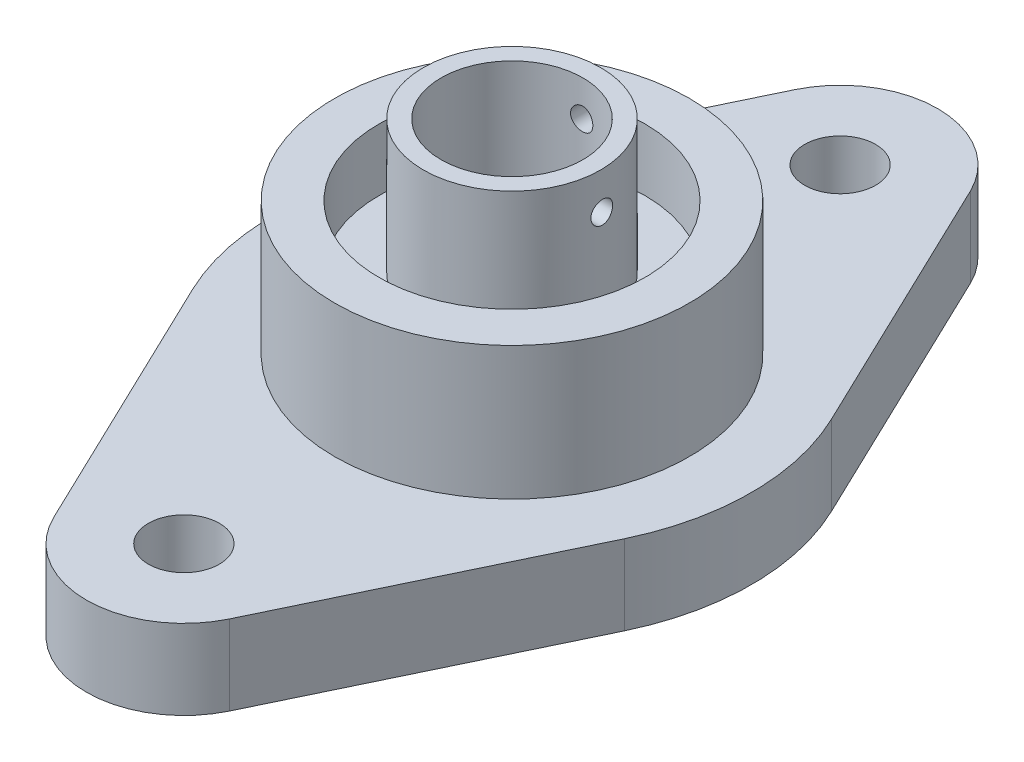
from build123d import *

# Parameters (mm, degrees)
SKETCH_1_R                         = 5
SKETCH_1_R_2                       = 4
EXTRUDE_1_DEPTH                    = 16
SKETCH_2_R                         = 7.5
SKETCH_2_R_2                       = 5
EXTRUDE_2_DEPTH                    = 8.5
SKETCH_3_R                         = 10
SKETCH_3_R_2                       = 7.5
EXTRUDE_3_DEPTH                    = 12
SKETCH_4_R                         = 10
SKETCH_4_R_2                       = 2
EXTRUDE_4_DEPTH                    = 4.5
HOLE_WIZARD_M1_6_1_REACH           = 35.405
HOLE_WIZARD_M1_6_1_BORE_R          = 0.625
HOLE_WIZARD_M1_6_1_ON_FACE_2_REACH = 36.922
HOLE_WIZARD_M1_6_1_BORE_2_R        = 0.625


with BuildPart() as part:
    # 草图1 → 凸台-拉伸1 (new body)
    with BuildSketch(Plane(origin=(0, 0, 0), x_dir=(1, 0, 0), z_dir=(0, 1, 0))):
        with Locations(Location((0, 0, 0), (0, 0, 270))):
            Circle(SKETCH_1_R)
        with Locations(Location((0, 0, 0), (0, 0, 270))):
            Circle(SKETCH_1_R_2, mode=Mode.SUBTRACT)
    extrude(amount=EXTRUDE_1_DEPTH)

    # 草图2 → 凸台-拉伸2 (add)
    with BuildSketch(Plane.XZ):
        with Locations(Location((0, 0, 0), (0, 0, 270))):
            Circle(SKETCH_2_R)
        with Locations(Location((0, 0, 0), (0, 0, 270))):
            Circle(SKETCH_2_R_2, mode=Mode.SUBTRACT)
    extrude(amount=-EXTRUDE_2_DEPTH)

    # 草图3 → 凸台-拉伸3 (add)
    with BuildSketch(Plane.XZ):
        with Locations(Location((0, 0, 0), (0, 0, 270))):
            Circle(SKETCH_3_R)
        with Locations(Location((0, 0, 0), (0, 0, 270))):
            Circle(SKETCH_3_R_2, mode=Mode.SUBTRACT)
    extrude(amount=-EXTRUDE_3_DEPTH)

    # 草图4 → 凸台-拉伸4 (add)
    with BuildSketch(Plane.XZ):
        with BuildLine():
            Line((4.959164878, -20.878378378), (12.17249561, -5.837837838))
            ThreePointArc((12.17249561, -5.837837838), (13.5, 0), (12.17249561, 5.837837838))
            Line((12.17249561, 5.837837838), (4.959164878, 20.878378378))
            ThreePointArc((4.959164878, 20.878378378), (0, 24), (-4.959164878, 20.878378378))
            Line((-4.959164878, 20.878378378), (-12.17249561, 5.837837838))
            ThreePointArc((-12.17249561, 5.837837838), (-13.5, 0), (-12.17249561, -5.837837838))
            Line((-12.17249561, -5.837837838), (-4.959164878, -20.878378378))
            ThreePointArc((-4.959164878, -20.878378378), (0, -24), (4.959164878, -20.878378378))
        make_face()
        with Locations(Location((0, 0, 0), (0, 0, 270))):
            Circle(SKETCH_4_R, mode=Mode.SUBTRACT)
        with Locations(Location((0, 18.5, 0), (0, 0, 270))):
            Circle(SKETCH_4_R_2, mode=Mode.SUBTRACT)
        with Locations(Location((0, -18.5, 0), (0, 0, 270))):
            Circle(SKETCH_4_R_2, mode=Mode.SUBTRACT)
    extrude(amount=-EXTRUDE_4_DEPTH)

    # M1.6 螺纹孔1 bore (on position points) → M1.6 螺纹孔1 (cut, up to next)
    with BuildSketch(Plane(origin=(4.998978572, 13.886776662, -0.101060544), x_dir=(0.020212108711, 0, 0.999795714464), z_dir=(0.999795714464, 0, -0.020212108711)), mode=Mode.PRIVATE) as hole_wizard_m1_6_1_sk1:
        Circle(HOLE_WIZARD_M1_6_1_BORE_R)
    hole_wizard_m1_6_1_tool1 = extrude(hole_wizard_m1_6_1_sk1.sketch, amount=-HOLE_WIZARD_M1_6_1_REACH, mode=Mode.PRIVATE) & part.part
    add(hole_wizard_m1_6_1_tool1.solids().sort_by_distance((4.998979, 13.886777, -0.101061))[0], mode=Mode.SUBTRACT)

    # M1.6 螺纹孔1 bore 2 (on position points) → M1.6 螺纹孔1 on face 2 (cut, up to next)
    with BuildSketch(Plane(origin=(-0.028423278, 13.983100373, -4.999919211), x_dir=(-0.999983840262, 0, 0.005684999092), z_dir=(-0.005684999092, 0, -0.999983840262)), mode=Mode.PRIVATE) as hole_wizard_m1_6_1_on_face_2_sk1:
        Circle(HOLE_WIZARD_M1_6_1_BORE_2_R)
    hole_wizard_m1_6_1_on_face_2_tool1 = extrude(hole_wizard_m1_6_1_on_face_2_sk1.sketch, amount=-HOLE_WIZARD_M1_6_1_ON_FACE_2_REACH, mode=Mode.PRIVATE) & part.part
    add(hole_wizard_m1_6_1_on_face_2_tool1.solids().sort_by_distance((-0.028423, 13.9831, -4.999919))[0], mode=Mode.SUBTRACT)


solid = part.part
